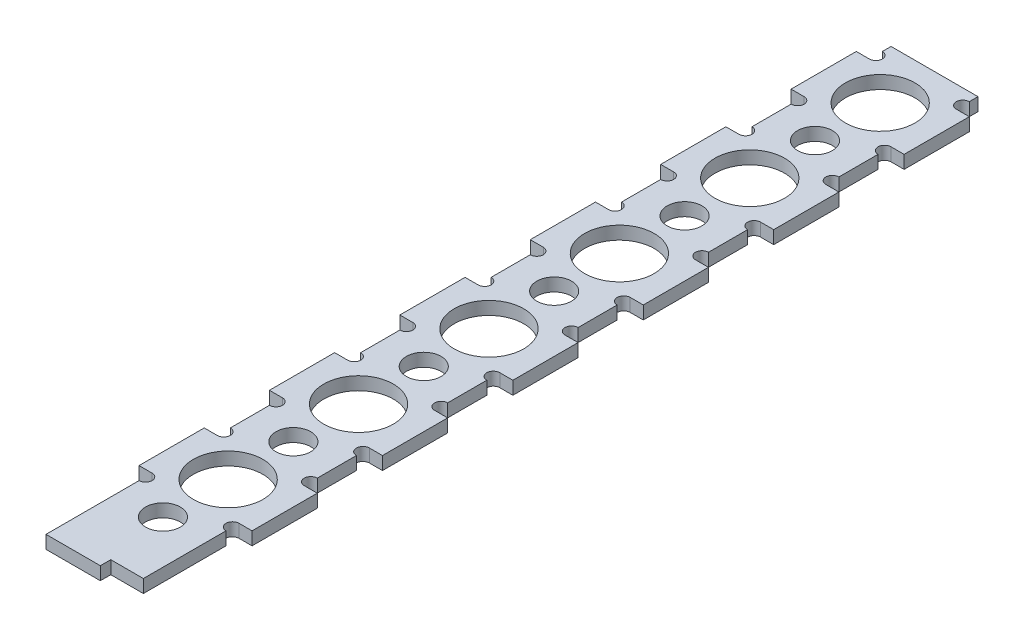
from build123d import *

# Parameters (mm, degrees)
SKETCH_1_W          = 20
SKETCH_1_H          = 194.9
EXTRUDE_1_DEPTH     = 3
SKETCH_2_W          = 7.5
SKETCH_2_H          = 2.9
CUT_EXTRUDE_1_DEPTH = 196.946446765
SKETCH_3_W          = 15
SKETCH_3_H          = 3
EXTRUDE_3_DEPTH     = 3
SKETCH_4_R          = 8
CUT_EXTRUDE_2_DEPTH = 197.275342313
SKETCH_5_R          = 4
CUT_EXTRUDE_3_DEPTH = 197.275342313
SKETCH_6_W          = 12.5
SKETCH_6_H          = 0.5
CUT_EXTRUDE_4_DEPTH = 197.275342313
SKETCH_7_R          = 1.5
CUT_EXTRUDE_5_DEPTH = 10


with BuildPart() as part:
    # 草图1 → 凸台-拉伸1 (new body)
    with BuildSketch(Plane(origin=(0, 0, 0), x_dir=(1, 0, 0), z_dir=(0, 1, 0))):
        with Locations((10, 97.45)):
            Rectangle(SKETCH_1_W, SKETCH_1_H)
    extrude(amount=EXTRUDE_1_DEPTH)

    # 草图2 → 切除-拉伸1 (cut, through all)
    with BuildSketch(Plane(origin=(0, 3, 0), x_dir=(1, 0, 0), z_dir=(0, 1, 0))):
        with Locations((16.25, 1.45)):
            Rectangle(SKETCH_2_W, SKETCH_2_H)
    extrude(amount=-CUT_EXTRUDE_1_DEPTH, mode=Mode.SUBTRACT)

    # 草图3 → 凸台-拉伸3 (add)
    with BuildSketch(Plane.ZY):
        with Locations((-182.4, 1.5)):
            Rectangle(SKETCH_3_W, SKETCH_3_H)
        with Locations((-152.4, 1.5)):
            Rectangle(SKETCH_3_W, SKETCH_3_H)
        with Locations((-122.4, 1.5)):
            Rectangle(SKETCH_3_W, SKETCH_3_H)
        with Locations((-92.4, 1.5)):
            Rectangle(SKETCH_3_W, SKETCH_3_H)
        with Locations((-62.4, 1.5)):
            Rectangle(SKETCH_3_W, SKETCH_3_H)
        with Locations((-32.4, 1.5)):
            Rectangle(SKETCH_3_W, SKETCH_3_H)
    extrude_3 = extrude(amount=EXTRUDE_3_DEPTH)

    # 镜向1: 凸台-拉伸3 across plane
    add(extrude_3.mirror(Plane.ZY.offset(-10)))

    # 草图4 → 切除-拉伸2 (cut, through all)
    with BuildSketch(Plane(origin=(0, 3, 0), x_dir=(1, 0, 0), z_dir=(0, 1, 0))):
        with Locations(Location((10, 182.4, 0), (0, 0, 270))):
            Circle(SKETCH_4_R)
        with Locations(Location((10, 152.4, 0), (0, 0, 270))):
            Circle(SKETCH_4_R)
        with Locations(Location((10, 122.4, 0), (0, 0, 270))):
            Circle(SKETCH_4_R)
        with Locations(Location((10, 92.4, 0), (0, 0, 270))):
            Circle(SKETCH_4_R)
        with Locations(Location((10, 62.4, 0), (0, 0, 270))):
            Circle(SKETCH_4_R)
        with Locations(Location((10, 32.4, 0), (0, 0, 270))):
            Circle(SKETCH_4_R)
    extrude(amount=-CUT_EXTRUDE_2_DEPTH, mode=Mode.SUBTRACT)

    # 草图5 → 切除-拉伸3 (cut, through all)
    with BuildSketch(Plane(origin=(0, 3, 0), x_dir=(1, 0, 0), z_dir=(0, 1, 0))):
        with Locations(Location((10, 167.4, 0), (0, 0, 270))):
            Circle(SKETCH_5_R)
        with Locations(Location((10, 137.4, 0), (0, 0, 270))):
            Circle(SKETCH_5_R)
        with Locations(Location((10, 107.4, 0), (0, 0, 270))):
            Circle(SKETCH_5_R)
        with Locations(Location((10, 77.4, 0), (0, 0, 270))):
            Circle(SKETCH_5_R)
        with Locations(Location((10, 47.4, 0), (0, 0, 270))):
            Circle(SKETCH_5_R)
        with Locations(Location((10, 17.4, 0), (0, 0, 270))):
            Circle(SKETCH_5_R)
    extrude(amount=-CUT_EXTRUDE_3_DEPTH, mode=Mode.SUBTRACT)

    # 草图6 → 切除-拉伸4 (cut, through all)
    with BuildSketch(Plane(origin=(0, 3, 0), x_dir=(1, 0, 0), z_dir=(0, 1, 0))):
        with Locations((6.25, 0.25)):
            Rectangle(SKETCH_6_W, SKETCH_6_H)
    extrude(amount=-CUT_EXTRUDE_4_DEPTH, mode=Mode.SUBTRACT)

    # 草图7 → 切除-拉伸5 (cut)
    with BuildSketch(Plane.XZ):
        with Locations((0, -23.4)):
            Circle(SKETCH_7_R)
        with Locations((0, -41.4)):
            Circle(SKETCH_7_R)
        with Locations((0, -53.4)):
            Circle(SKETCH_7_R)
        with Locations((0, -71.4)):
            Circle(SKETCH_7_R)
        with Locations((0, -83.4)):
            Circle(SKETCH_7_R)
        with Locations((0, -101.4)):
            Circle(SKETCH_7_R)
        with Locations((0, -113.4)):
            Circle(SKETCH_7_R)
        with Locations((0, -131.4)):
            Circle(SKETCH_7_R)
        with Locations((0, -143.4)):
            Circle(SKETCH_7_R)
        with Locations((0, -161.4)):
            Circle(SKETCH_7_R)
        with Locations((0, -173.4)):
            Circle(SKETCH_7_R)
        with Locations((0, -191.4)):
            Circle(SKETCH_7_R)
        with Locations((20, -191.4)):
            Circle(SKETCH_7_R)
        with Locations((20, -173.4)):
            Circle(SKETCH_7_R)
        with Locations((20, -161.4)):
            Circle(SKETCH_7_R)
        with Locations((20, -143.4)):
            Circle(SKETCH_7_R)
        with Locations((20, -131.4)):
            Circle(SKETCH_7_R)
        with Locations((20, -113.4)):
            Circle(SKETCH_7_R)
        with Locations((20, -101.4)):
            Circle(SKETCH_7_R)
        with Locations((20, -83.4)):
            Circle(SKETCH_7_R)
        with Locations((20, -71.4)):
            Circle(SKETCH_7_R)
        with Locations((20, -53.4)):
            Circle(SKETCH_7_R)
        with Locations((20, -41.4)):
            Circle(SKETCH_7_R)
        with Locations((20, -23.4)):
            Circle(SKETCH_7_R)
    extrude(amount=-CUT_EXTRUDE_5_DEPTH, mode=Mode.SUBTRACT)


solid = part.part
